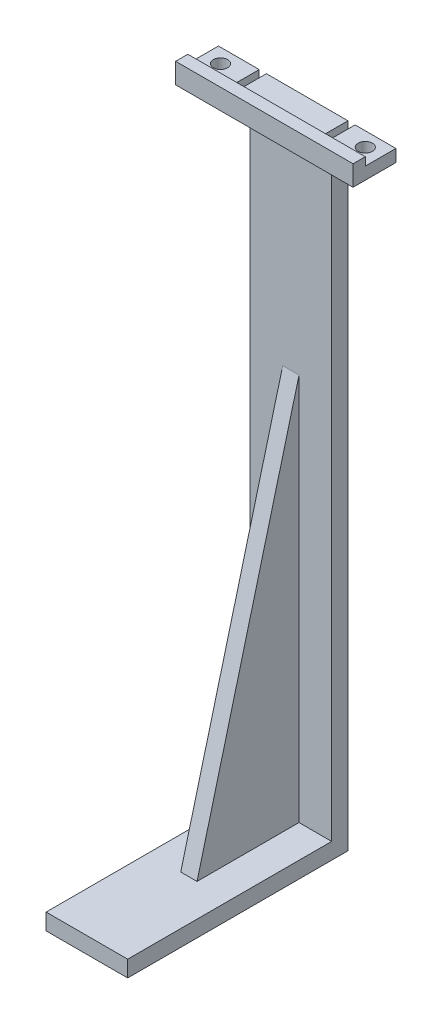
from build123d import *

# Parameters (mm, degrees)
SKETCH1_W           = 20
SKETCH1_H           = 155
BOSS_EXTRUDE1_DEPTH = 4
SKETCH2_W           = 20
SKETCH2_H           = 4
BOSS_EXTRUDE3_DEPTH = 50
RIB2_REACH          = 96.986
SKETCH7_WALL_W      = 290.205463948
SKETCH7_WALL_H      = 4
SKETCH8_W           = 20
SKETCH8_H           = 3
BOSS_EXTRUDE4_DEPTH = 3.5
BOSS_EXTRUDE6_DEPTH = 3
SKETCH10_W          = 10
SKETCH10_H          = 3
BOSS_EXTRUDE7_DEPTH = 7.5
SKETCH12_R          = 1.75
CUT_EXTRUDE1_DEPTH  = 10


with BuildPart() as part:
    # Sketch1 → Boss-Extrude1 (new body)
    with BuildSketch(Plane.XY):
        Rectangle(SKETCH1_W, SKETCH1_H)
    extrude(amount=BOSS_EXTRUDE1_DEPTH)

    # Sketch2 → Boss-Extrude3 (add)
    with BuildSketch(Plane.XY.offset(4)):
        with Locations((0, -75.5)):
            Rectangle(SKETCH2_W, SKETCH2_H)
    extrude(amount=BOSS_EXTRUDE3_DEPTH)

    # Sketch7 wall → Rib2 (add, up to next)
    with BuildSketch(Plane(origin=(0, -26, 16.5), x_dir=(0, 0.967074537263, -0.25449329928), z_dir=(0, 0.25449329928, 0.967074537263)), mode=Mode.PRIVATE) as rib2_sk1:
        Rectangle(SKETCH7_WALL_W, SKETCH7_WALL_H)
    rib2_tool1 = extrude(rib2_sk1.sketch, amount=-RIB2_REACH, mode=Mode.PRIVATE) - part.part
    add(rib2_tool1.solids().sort_by_distance((0, -26, 16.5))[0])

    # Sketch8 → Boss-Extrude4 (add)
    with BuildSketch(Plane.XY.offset(4)):
        with Locations((0, 76)):
            Rectangle(SKETCH8_W, SKETCH8_H)
    extrude(amount=BOSS_EXTRUDE4_DEPTH)

    # Sketch9 → Boss-Extrude6 (add)
    with BuildSketch(Plane.XY.offset(7.5)):
        Polygon((-21.75, 74.5), (0, 74.5), (21.75, 74.5), (21.75, 79.5), (-21.75, 79.5), align=None)
    extrude(amount=BOSS_EXTRUDE6_DEPTH)

    # Sketch10 → Boss-Extrude7 (add)
    with BuildSketch(Plane(origin=(0, 0, 7.5), x_dir=(-1, 0, 0), z_dir=(0, 0, -1))):
        with Locations((16.75, 76)):
            Rectangle(SKETCH10_W, SKETCH10_H)
        with Locations((-16.75, 76)):
            Rectangle(SKETCH10_W, SKETCH10_H)
    extrude(amount=BOSS_EXTRUDE7_DEPTH)

    # Sketch12 → Cut-Extrude1 (cut)
    with BuildSketch(Plane(origin=(0, 77.5, 0), x_dir=(1, 0, 0), z_dir=(0, 1, 0))):
        with Locations(Location((-17.75, -3.5, 0), (0, 0, 270))):
            Circle(SKETCH12_R)
        with Locations(Location((17.75, -3.5, 0), (0, 0, 270))):
            Circle(SKETCH12_R)
    extrude(amount=-CUT_EXTRUDE1_DEPTH, mode=Mode.SUBTRACT)


solid = part.part
